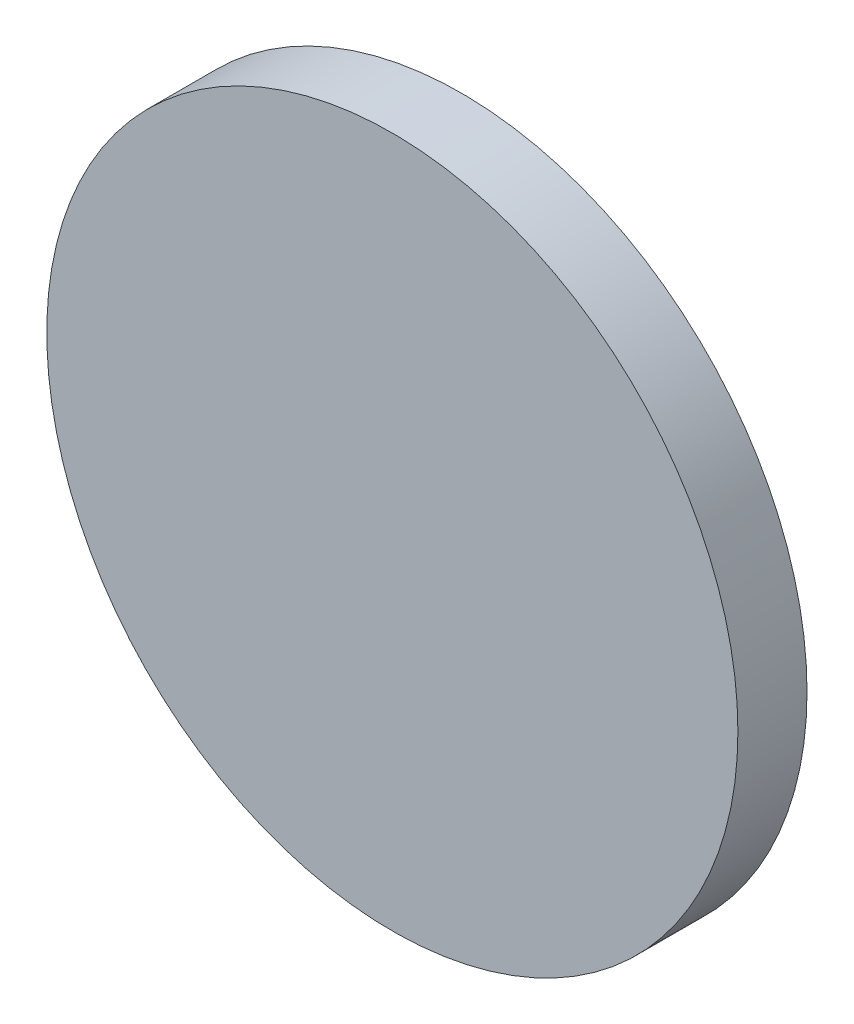
from build123d import *

# Parameters (mm, degrees)
SKETCH1_R           = 15
SKETCH1_R_2         = 4
BOSS_EXTRUDE1_DEPTH = 3
SKETCH2_R           = 4
SKETCH2_R_2         = 3.5
BOSS_EXTRUDE2_DEPTH = 5
SKETCH4_R           = 4
BOSS_EXTRUDE4_DEPTH = 3


with BuildPart() as part:
    # Sketch1 → Boss-Extrude1 (new body)
    with BuildSketch(Plane.XY):
        with Locations((-0.860205172, 39.990749519)):
            Circle(SKETCH1_R)
        with Locations((-0.860205172, 39.990749519)):
            Circle(SKETCH1_R_2, mode=Mode.SUBTRACT)
    extrude(amount=BOSS_EXTRUDE1_DEPTH)



with BuildPart() as body_2:
    # Sketch2 → Boss-Extrude2 (new body)
    with BuildSketch(Plane(origin=(0, 0, 0), x_dir=(-1, 0, 0), z_dir=(0, 0, -1))):
        with Locations(Location((0.860205172, 39.990749519, 0), (0, 0, 180))):
            Circle(SKETCH2_R)
        with Locations((0.860205172, 39.990749519)):
            Circle(SKETCH2_R_2, mode=Mode.SUBTRACT)
    extrude(amount=BOSS_EXTRUDE2_DEPTH)


with BuildPart() as part_1:
    add(part.part)

    add(body_2.part)  # Boss-Extrude4 merges body 2
    # Sketch4 → Boss-Extrude4 (add)
    with BuildSketch(Plane.XY):
        with Locations((-0.860205172, 39.990749519)):
            Circle(SKETCH4_R)
    extrude(amount=BOSS_EXTRUDE4_DEPTH)


solid = part_1.part
